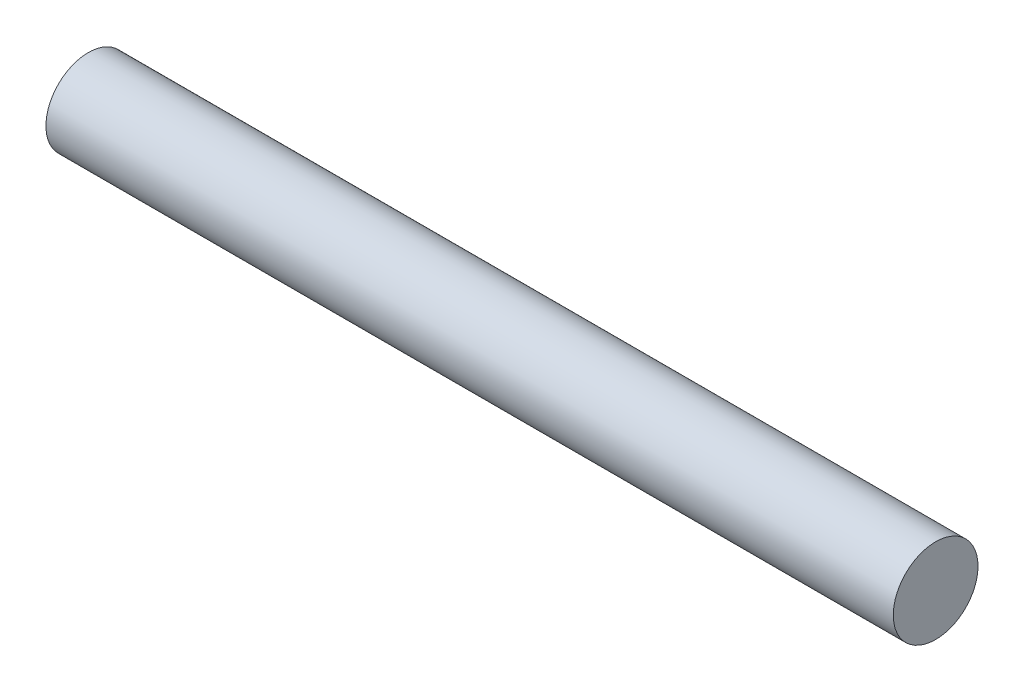
from build123d import *

# Parameters (mm, degrees)
CROQUIS1_R              = 1.5
SALIENTE_EXTRUIR1_DEPTH = 30


with BuildPart() as part:
    # Croquis1 → Saliente-Extruir1 (new body)
    with BuildSketch(Plane(origin=(0, 0, 0), x_dir=(0, 0, -1), z_dir=(1, 0, 0))):
        Circle(CROQUIS1_R)
    extrude(amount=SALIENTE_EXTRUIR1_DEPTH)


solid = part.part
